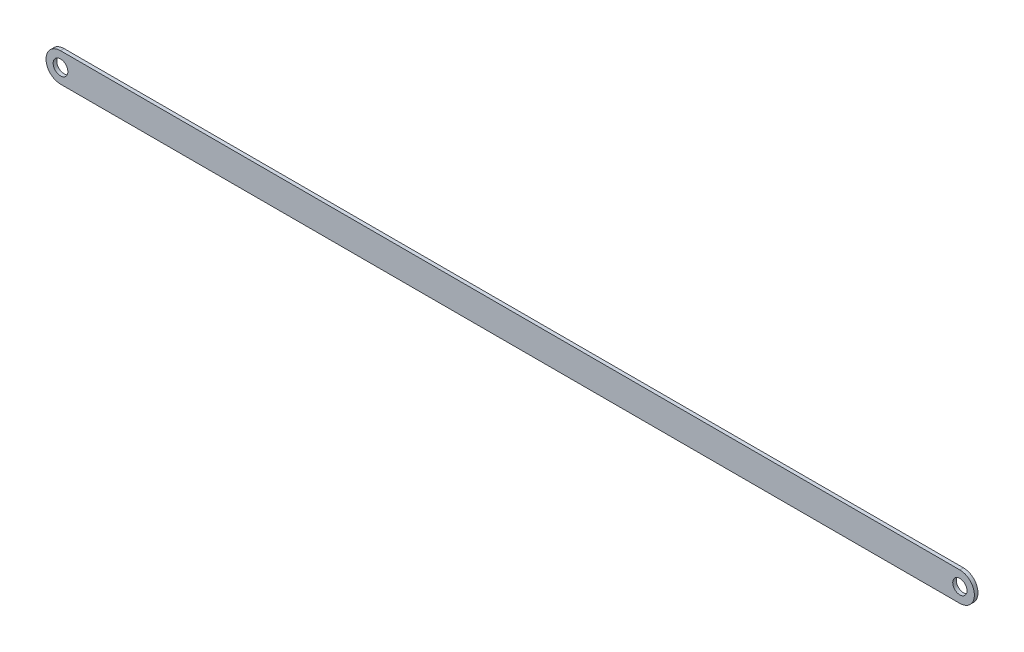
from build123d import *

# Parameters (mm, degrees)
SKETCH1_R           = 6.430069769
SKETCH1_R_2         = 6.247756724
BOSS_EXTRUDE1_DEPTH = 3.175


with BuildPart() as part:
    # Sketch1 → Boss-Extrude1 (new body)
    with BuildSketch(Plane.XY):
        with BuildLine():
            Line((0, 12.7), (787.4, 12.7))
            ThreePointArc((787.4, 12.7), (800.1, 0), (787.4, -12.7))
            Line((787.4, -12.7), (0, -12.7))
            ThreePointArc((0, -12.7), (-12.7, 0), (0, 12.7))
        make_face()
        Circle(SKETCH1_R, mode=Mode.SUBTRACT)
        with Locations((787.4, 0)):
            Circle(SKETCH1_R_2, mode=Mode.SUBTRACT)
    extrude(amount=BOSS_EXTRUDE1_DEPTH)


solid = part.part
